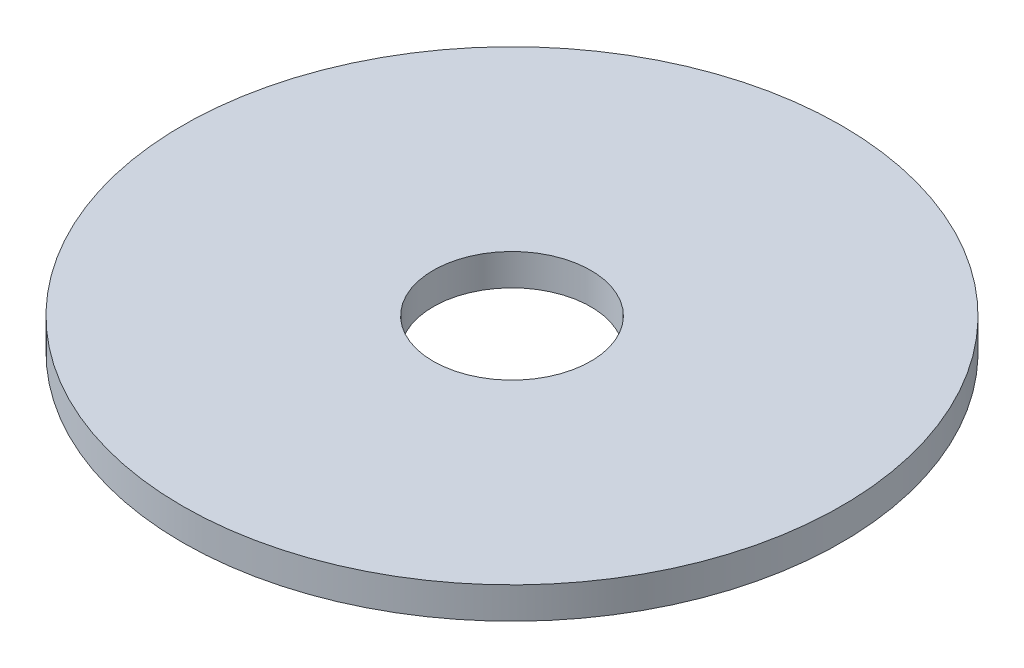
from build123d import *

# Parameters (mm, degrees)
SKETCH1_R           = 104.55
SKETCH1_R_2         = 25
BOSS_EXTRUDE1_DEPTH = 10


with BuildPart() as part:
    # Sketch1 → Boss-Extrude1 (new body)
    with BuildSketch(Plane(origin=(0, 0, 0), x_dir=(1, 0, 0), z_dir=(0, 1, 0))):
        with Locations(Location((0, 0, 0), (0, 0, 270))):
            Circle(SKETCH1_R)
        with Locations(Location((0, 0, 0), (0, 0, 270))):
            Circle(SKETCH1_R_2, mode=Mode.SUBTRACT)
    extrude(amount=BOSS_EXTRUDE1_DEPTH)


solid = part.part
